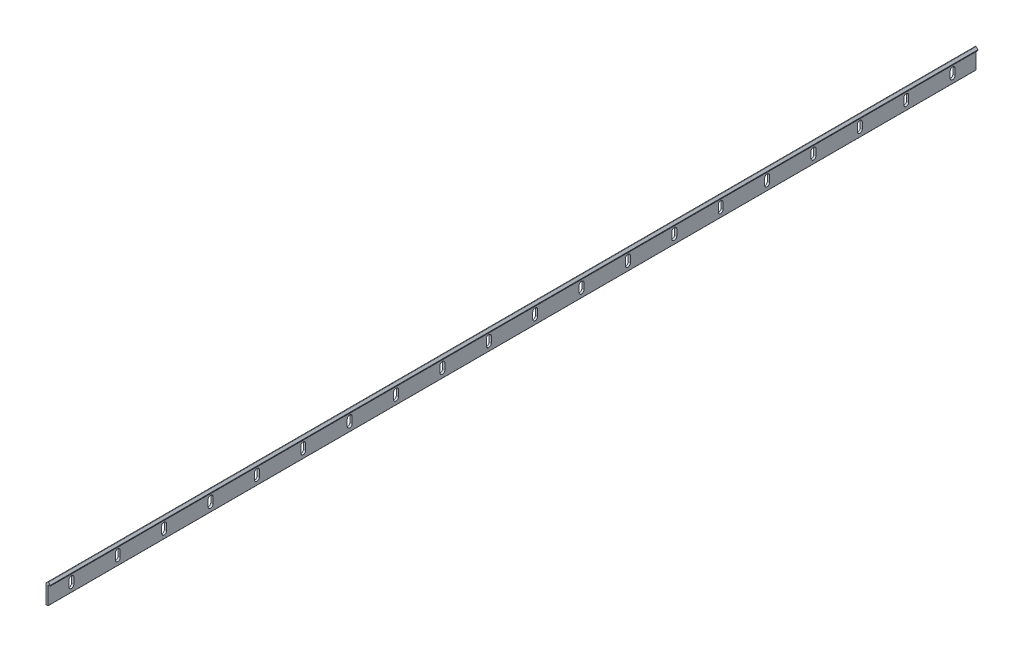
from build123d import *

# Parameters (mm, degrees)
BOSS_EXTRUDE1_DEPTH = 1000
FILLET1_R           = 0.50329666
FILLET2_R           = 0.50398302
FILLET3_R           = 0.30157619
FILLET4_R           = 0.30157551
CUT_EXTRUDE1_REACH  = 1002.264
LPATTERN1_COUNT     = 20
LPATTERN1_PITCH     = 50


with BuildPart() as part:
    # Sketch1 → Boss-Extrude1 (new body)
    with BuildSketch(Plane.XY):
        with BuildLine():
            Line((0, 20.330194912), (2.019589054, 22.349783966))
            ThreePointArc((2.019589054, 22.349783966), (2.375, 22.497), (2.730410946, 22.349783966))
            Line((2.730410946, 22.349783966), (4.75, 20.330194912))
            Line((4.75, 20.330194912), (4.75, 19.5291))
            Line((4.75, 19.5291), (2.375, 19.5291))
            Line((2.375, 19.5291), (2.375, 0))
            Line((2.375, 0), (0, 0))
            Line((0, 0), (0, 20.330194912))
        make_face()
    extrude(amount=BOSS_EXTRUDE1_DEPTH)

    # Fillet1
    fillet1_edges = [part.edges().sort_by_distance(p)[0] for p in [
        (0, 20.330194912, 500),
    ]]
    fillet(fillet1_edges, radius=FILLET1_R)

    # Fillet2
    fillet2_edges = [part.edges().sort_by_distance(p)[0] for p in [
        (4.75, 20.330194912, 500),
    ]]
    fillet(fillet2_edges, radius=FILLET2_R)

    # Fillet3
    fillet3_edges = [part.edges().sort_by_distance(p)[0] for p in [
        (4.75, 19.5291, 500),
    ]]
    fillet(fillet3_edges, radius=FILLET3_R)

    # Fillet4
    fillet4_edges = [part.edges().sort_by_distance(p)[0] for p in [
        (2.375, 0, 500),
        (0, 0, 500),
    ]]
    fillet(fillet4_edges, radius=FILLET4_R)

    # Sketch2 → Cut-Extrude1 (cut, up to next)
    with BuildSketch(Plane.ZY, mode=Mode.PRIVATE) as cut_extrude1_sk1:
        with BuildLine():
            Line((27.65, 13.1043), (27.65, 6.4043))
            ThreePointArc((27.65, 6.4043), (25, 3.7543), (22.35, 6.4043))
            Line((22.35, 6.4043), (22.35, 13.1043))
            ThreePointArc((22.35, 13.1043), (25, 15.7543), (27.65, 13.1043))
        make_face()
    cut_extrude1_tool1 = extrude(cut_extrude1_sk1.sketch, amount=-CUT_EXTRUDE1_REACH, mode=Mode.PRIVATE) & part.part
    cut_extrude1 = cut_extrude1_tool1.solids().sort_by_distance((0, 9.7543, 25))[0]
    add(cut_extrude1, mode=Mode.SUBTRACT)

    # LPattern1: Cut-Extrude1 ×20
    with Locations(*[(0, 0, i * LPATTERN1_PITCH) for i in range(1, LPATTERN1_COUNT)]):
        add(cut_extrude1, mode=Mode.SUBTRACT)


solid = part.part
